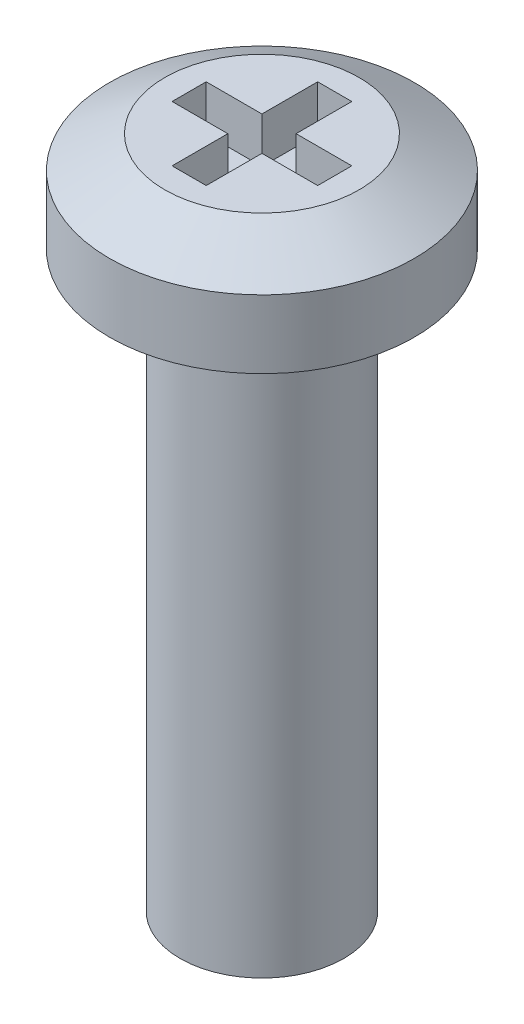
from build123d import *

# Parameters (mm, degrees)
SKETCH1_R           = 3.35
BOSS_EXTRUDE1_DEPTH = 1.5
SKETCH2_R           = 3.35
BOSS_EXTRUDE2_DEPTH = 0.7
BOSS_EXTRUDE2_TAPER = 60
SKETCH3_W           = 1.225
SKETCH3_H           = 0.75
SKETCH3_W_2         = 0.75
SKETCH3_H_2         = 1.225
CUT_EXTRUDE1_DEPTH  = 1
SKETCH4_R           = 1.8
BOSS_EXTRUDE3_DEPTH = 12.6


with BuildPart() as part:
    # Sketch1 → Boss-Extrude1 (new body)
    with BuildSketch(Plane(origin=(0, 0, 0), x_dir=(1, 0, 0), z_dir=(0, 1, 0))):
        with Locations(Location((0, 0, 0), (0, 0, 270))):
            Circle(SKETCH1_R)
    extrude(amount=BOSS_EXTRUDE1_DEPTH)

    # Sketch2 → Boss-Extrude2 (add)
    with BuildSketch(Plane(origin=(0, 1.5, 0), x_dir=(1, 0, 0), z_dir=(0, 1, 0))):
        with Locations(Location((0, 0, 0), (0, 0, 270))):
            Circle(SKETCH2_R)
    extrude(amount=BOSS_EXTRUDE2_DEPTH, taper=BOSS_EXTRUDE2_TAPER)

    # Sketch3 → Cut-Extrude1 (cut)
    with BuildSketch(Plane(origin=(0, 2.2, 0), x_dir=(1, 0, 0), z_dir=(0, 1, 0))):
        with Locations((-0.9875, 0)):
            Rectangle(SKETCH3_W, SKETCH3_H)
        with Locations((0, 0.9875)):
            Rectangle(SKETCH3_W_2, SKETCH3_H_2)
        with Locations((0.9875, 0)):
            Rectangle(SKETCH3_W, SKETCH3_H)
        with Locations((0, -0.9875)):
            Rectangle(SKETCH3_W_2, SKETCH3_H_2)
        Rectangle(SKETCH3_W_2, SKETCH3_H)
    extrude(amount=-CUT_EXTRUDE1_DEPTH, mode=Mode.SUBTRACT)

    # Sketch4 → Boss-Extrude3 (add)
    with BuildSketch(Plane.XZ):
        with Locations(Location((0, 0, 0), (0, 0, 90))):
            Circle(SKETCH4_R)
    extrude(amount=BOSS_EXTRUDE3_DEPTH)


solid = part.part
